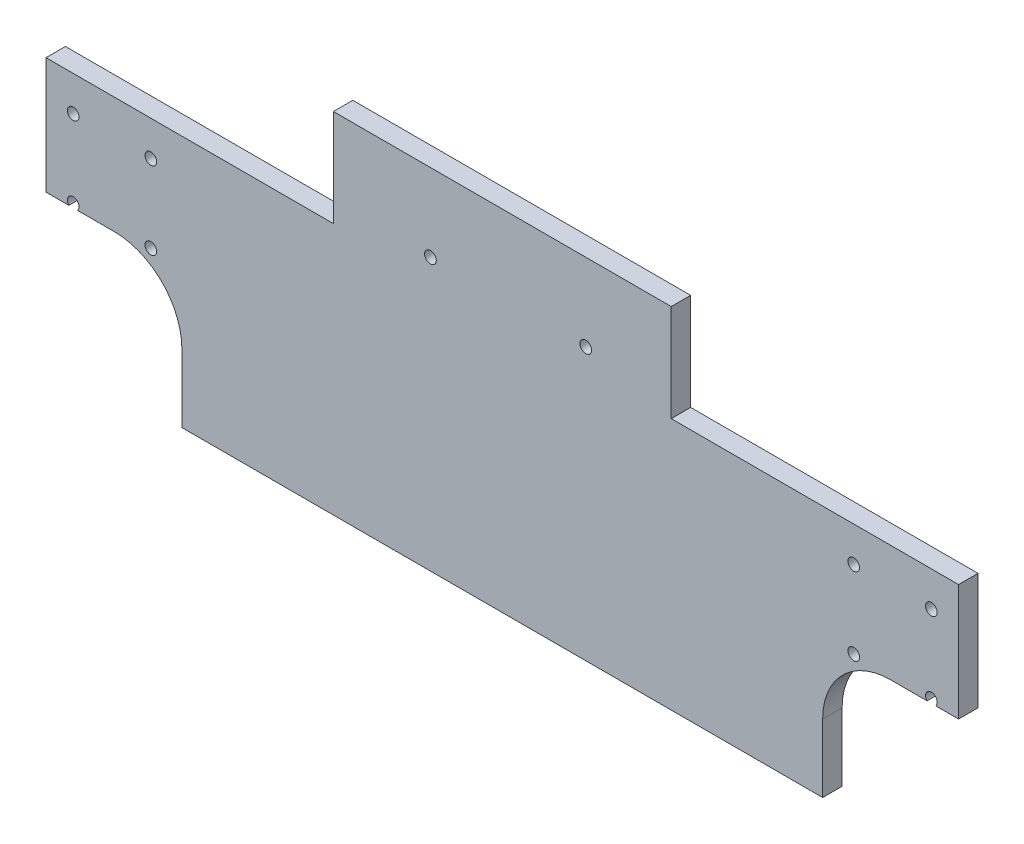
from build123d import *

# Parameters (mm, degrees)
ESQUISSE1_R        = 1.5
BOSS_EXTRU_1_DEPTH = 5


with BuildPart() as part:
    # Esquisse1 → Boss.-Extru.1 (new body)
    with BuildSketch(Plane.XY):
        with BuildLine():
            Line((35, 17.5), (35, 0))
            Line((35, 0), (200, 0))
            Line((200, 0), (200, 17.5))
            ThreePointArc((200, 17.5), (205.125631329, 29.874368671), (217.5, 35))
            Line((217.5, 35), (226.881966011, 35))
            ThreePointArc((226.881966011, 35), (227.464766865, 37.401258538), (229.5, 36))
            ThreePointArc((229.5, 36), (229.401258538, 35.464766865), (229.118033989, 35))
            Line((229.118033989, 35), (235, 35))
            Line((235, 35), (235, 65))
            Line((235, 65), (161, 65))
            Line((161, 65), (161, 90))
            Line((161, 90), (74, 90))
            Line((74, 90), (74, 65))
            Line((74, 65), (0, 65))
            Line((0, 65), (0, 35))
            Line((0, 35), (5.881966011, 35))
            ThreePointArc((5.881966011, 35), (6.464766865, 37.401258538), (8.5, 36))
            ThreePointArc((8.5, 36), (8.401258538, 35.464766865), (8.118033989, 35))
            Line((8.118033989, 35), (17.5, 35))
            ThreePointArc((17.5, 35), (29.874368671, 29.874368671), (35, 17.5))
        make_face()
        with Locations((27, 36)):
            Circle(ESQUISSE1_R, mode=Mode.SUBTRACT)
        with Locations((208, 36)):
            Circle(ESQUISSE1_R, mode=Mode.SUBTRACT)
        with Locations((7, 56)):
            Circle(ESQUISSE1_R, mode=Mode.SUBTRACT)
        with Locations((27, 56)):
            Circle(ESQUISSE1_R, mode=Mode.SUBTRACT)
        with Locations((99, 70)):
            Circle(ESQUISSE1_R, mode=Mode.SUBTRACT)
        with Locations((208, 56)):
            Circle(ESQUISSE1_R, mode=Mode.SUBTRACT)
        with Locations((228, 56)):
            Circle(ESQUISSE1_R, mode=Mode.SUBTRACT)
        with Locations((139, 70)):
            Circle(ESQUISSE1_R, mode=Mode.SUBTRACT)
    extrude(amount=BOSS_EXTRU_1_DEPTH)


solid = part.part
